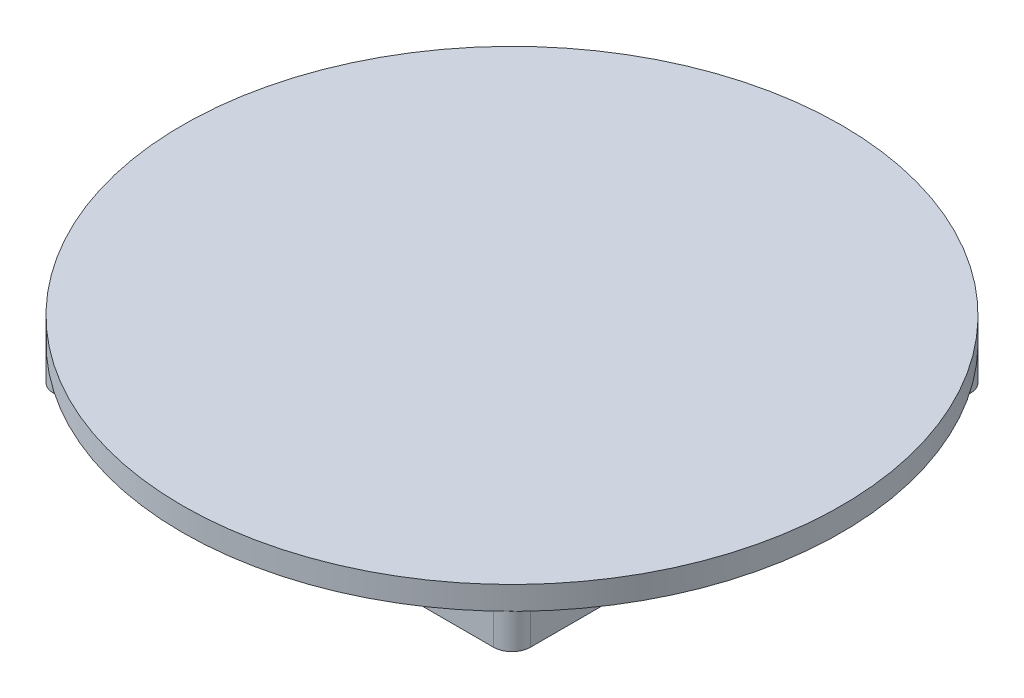
from build123d import *

# Parameters (mm, degrees)
BOSS_EXTRUDE1_DEPTH = 7.5
SKETCH4_R           = 70.821590822
BOSS_EXTRUDE3_DEPTH = 5
SKETCH5_R           = 1.9
SKETCH5_R_2         = 1.1
CUT_EXTRUDE1_DEPTH  = 5
CIRPATTERN1_COUNT   = 4
SKETCH7_R           = 1.9
SKETCH7_R_2         = 1.1
CUT_EXTRUDE2_DEPTH  = 5
CIRPATTERN2_COUNT   = 4


with BuildPart() as part:
    # Sketch1 → Boss-Extrude1 (new body)
    with BuildSketch(Plane(origin=(0, 0, 0), x_dir=(1, 0, 0), z_dir=(0, 1, 0))):
        with BuildLine():
            ThreePointArc((-42.003937008, 34.906496063), (-44.832364133, 33.734923188), (-46.003937008, 30.906496063))
            Line((-46.003937008, 30.906496063), (-46.003937008, -63.593503937))
            ThreePointArc((-46.003937008, -63.593503937), (-44.832364133, -66.421931062), (-42.003937008, -67.593503937))
            Line((-42.003937008, -67.593503937), (52.496062992, -67.593503937))
            ThreePointArc((52.496062992, -67.593503937), (55.324490117, -66.421931062), (56.496062992, -63.593503937))
            Line((56.496062992, -63.593503937), (56.496062992, 30.906496063))
            ThreePointArc((56.496062992, 30.906496063), (55.324490117, 33.734923188), (52.496062992, 34.906496063))
            Line((52.496062992, 34.906496063), (-42.003937008, 34.906496063))
        make_face()
        with BuildLine():
            ThreePointArc((-14.128662812, 3.031221868), (5.246062992, 11.056496063), (24.620788797, 3.031221868))
            ThreePointArc((24.620788797, 3.031221868), (30.560362183, -5.85797789), (32.646062992, -16.343503937))
            ThreePointArc((32.646062992, -16.343503937), (15.731589039, -41.657803128), (-14.128662812, -35.718229742))
            ThreePointArc((-14.128662812, -35.718229742), (-22.153937008, -16.343503937), (-14.128662812, 3.031221868))
        make_face(mode=Mode.SUBTRACT)
    extrude(amount=BOSS_EXTRUDE1_DEPTH)

    # Sketch5 → Cut-Extrude1 (cut)
    with BuildSketch(Plane(origin=(0, 7.5, 0), x_dir=(1, 0, 0), z_dir=(0, 1, 0))):
        with Locations((45.696062992, -56.793503937)):
            Circle(SKETCH5_R)
        with Locations((40.196062992, -51.293503937)):
            Circle(SKETCH5_R_2)
    cut_extrude1 = extrude(amount=-CUT_EXTRUDE1_DEPTH, mode=Mode.SUBTRACT)

    # CirPattern1: Cut-Extrude1 ×4 about axis
    cirpattern1_axis = Axis((5.246062992, 121.392189585, 16.343503937), (0, -1, 0))
    for i in range(1, CIRPATTERN1_COUNT):
        add(cut_extrude1.rotate(cirpattern1_axis, i * 360 / CIRPATTERN1_COUNT), mode=Mode.SUBTRACT)

    # Sketch7 → Cut-Extrude2 (cut)
    with BuildSketch(Plane(origin=(0, 0, 0), x_dir=(-1, 0, 0), z_dir=(0, -1, 0))):
        with Locations((39.603937008, -61.193503937)):
            Circle(SKETCH7_R)
        with Locations((32.273937008, -53.863503937)):
            Circle(SKETCH7_R_2)
    cut_extrude2 = extrude(amount=-CUT_EXTRUDE2_DEPTH, mode=Mode.SUBTRACT)

    # CirPattern2: Cut-Extrude2 ×4 about axis
    cirpattern2_axis = Axis((5.246062992, 121.392189585, 16.343503937), (0, -1, 0))
    for i in range(1, CIRPATTERN2_COUNT):
        add(cut_extrude2.rotate(cirpattern2_axis, i * 360 / CIRPATTERN2_COUNT), mode=Mode.SUBTRACT)


with BuildPart() as body_2:
    # Sketch4 → Boss-Extrude3 (new body)
    with BuildSketch(Plane(origin=(0, 7.5, 0), x_dir=(1, 0, 0), z_dir=(0, 1, 0))):
        with Locations((5.246062992, -16.343503937)):
            Circle(SKETCH4_R)
    extrude(amount=BOSS_EXTRUDE3_DEPTH)


solid = Compound([part.part, body_2.part])
